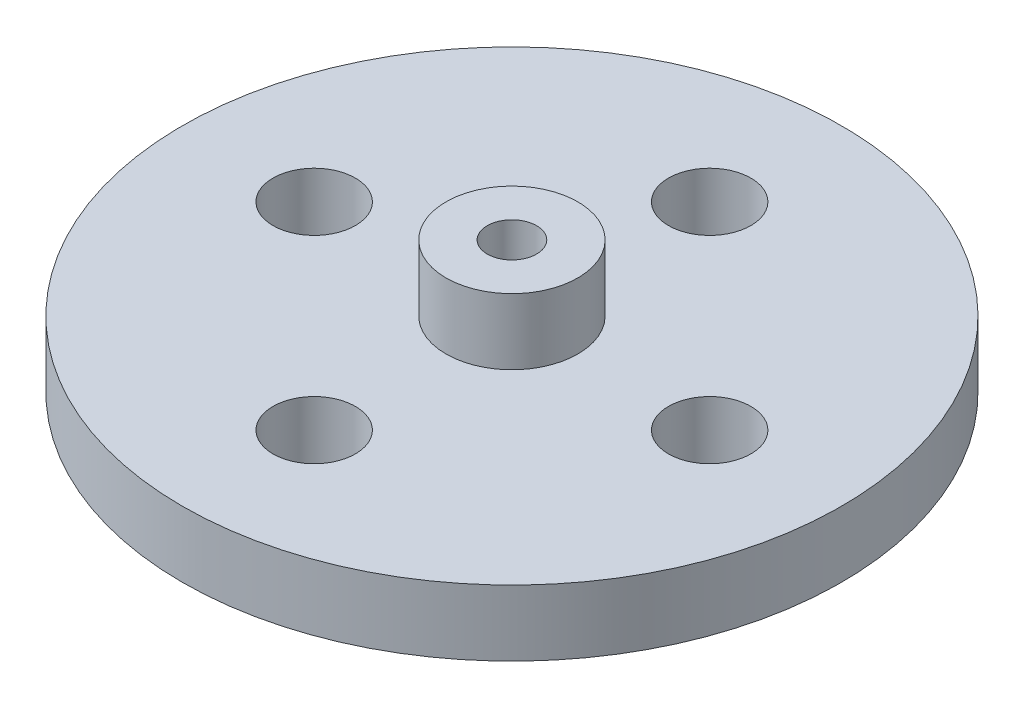
from build123d import *

# Parameters (mm, degrees)
SKETCH1_R                   = 31.75
BOSS_EXTRUDE1_DEPTH         = 6.35
SKETCH2_R                   = 6.35
BOSS_EXTRUDE2_DEPTH         = 6.35
SKETCH3_R                   = 2.3749
CUT_EXTRUDE1_DEPTH          = 47.6627796
F_3_8_16_TAPPED_HOLE1_D     = 7.9375
F_3_8_16_TAPPED_HOLE1_DEPTH = 26.924
F_3_8_16_TAPPED_HOLE1_TIP   = 2.384665582


with BuildPart() as part:
    # Sketch1 → Boss-Extrude1 (new body)
    with BuildSketch(Plane(origin=(0, 0, 0), x_dir=(1, 0, 0), z_dir=(0, 1, 0))):
        with Locations(Location((0, 0, 0), (0, 0, 270))):
            Circle(SKETCH1_R)
    extrude(amount=BOSS_EXTRUDE1_DEPTH)

    # Sketch2 → Boss-Extrude2 (add)
    with BuildSketch(Plane(origin=(0, 6.35, 0), x_dir=(1, 0, 0), z_dir=(0, 1, 0))):
        with Locations(Location((0, 0, 0), (0, 0, 270))):
            Circle(SKETCH2_R)
    extrude(amount=BOSS_EXTRUDE2_DEPTH)

    # Sketch3 → Cut-Extrude1 (cut, through all)
    with BuildSketch(Plane(origin=(0, 12.7, 0), x_dir=(1, 0, 0), z_dir=(0, 1, 0))):
        with Locations(Location((0, 0, 0), (0, 0, 270))):
            Circle(SKETCH3_R)
    extrude(amount=-CUT_EXTRUDE1_DEPTH, mode=Mode.SUBTRACT)

    # 3/8-16 Tapped Hole1
    with Locations(Plane(origin=(0, 6.35, 0), x_dir=(1, 0, 0), z_dir=(0, 1, 0))):
        with Locations((0, 19.05), (19.05, 0), (0, -19.05), (-19.05, 0)):
            Hole(F_3_8_16_TAPPED_HOLE1_D / 2, depth=F_3_8_16_TAPPED_HOLE1_DEPTH)
            with Locations((0, 0, -(F_3_8_16_TAPPED_HOLE1_DEPTH + F_3_8_16_TAPPED_HOLE1_TIP / 2))):  # 118° drill point
                Cone(0, F_3_8_16_TAPPED_HOLE1_D / 2, F_3_8_16_TAPPED_HOLE1_TIP, mode=Mode.SUBTRACT)


solid = part.part
